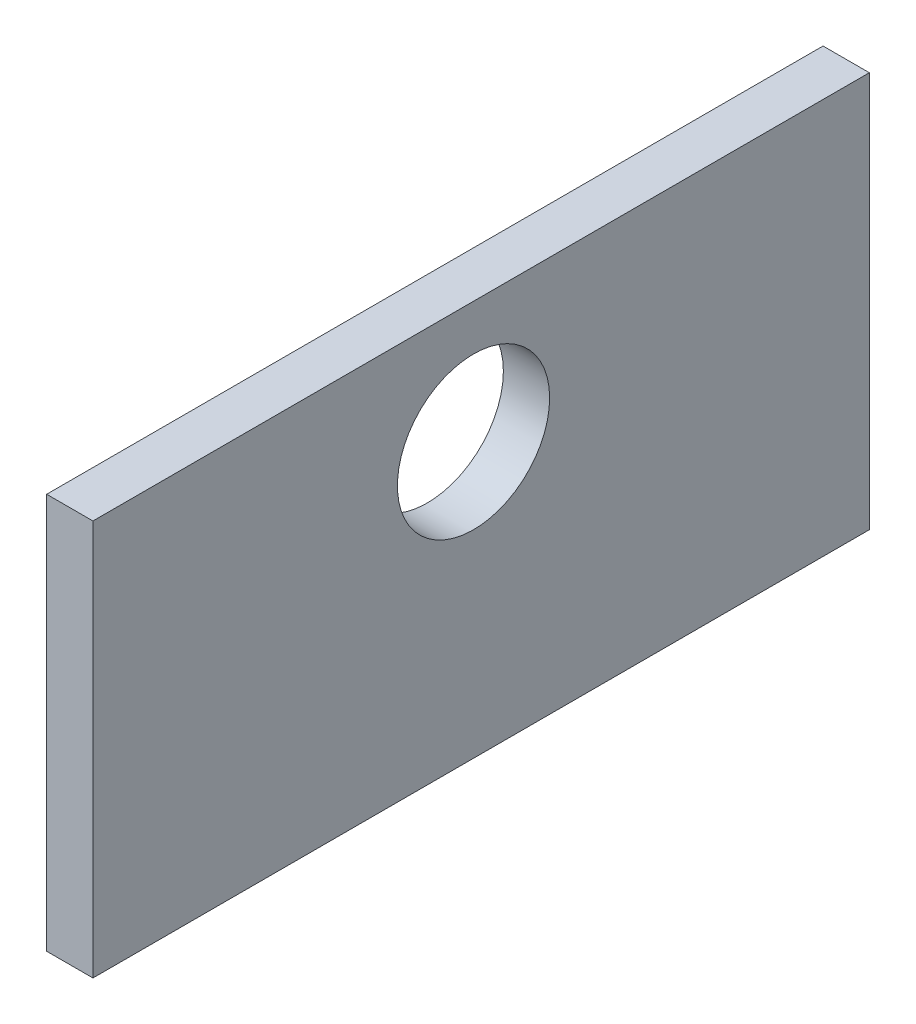
from build123d import *

# Parameters (mm, degrees)
SKETCH1_W           = 80.9625
SKETCH1_H           = 41.275
SKETCH1_R           = 7.9375
BOSS_EXTRUDE1_DEPTH = 4.826


with BuildPart() as part:
    # Sketch1 → Boss-Extrude1 (new body)
    with BuildSketch(Plane(origin=(0, 0, 0), x_dir=(0, 0, -1), z_dir=(1, 0, 0))):
        with Locations((0.79375, -7.9375)):
            Rectangle(SKETCH1_W, SKETCH1_H)
        Circle(SKETCH1_R, mode=Mode.SUBTRACT)
    extrude(amount=BOSS_EXTRUDE1_DEPTH)


solid = part.part
